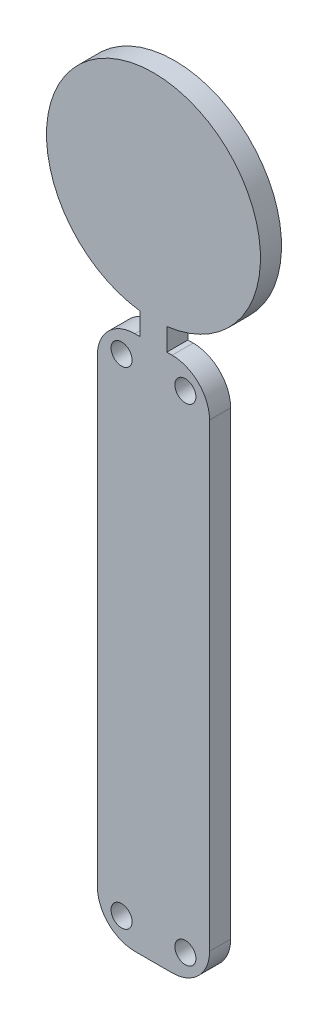
from build123d import *

# Parameters (mm, degrees)
BOSS_EXTRUDE1_DEPTH = 0.25
SKETCH4_R           = 0.25
CUT_EXTRUDE1_DEPTH  = 9.5


with BuildPart() as part:
    # Sketch2 → Boss-Extrude1 (new, symmetric)
    with BuildSketch(Plane.XY):
        with BuildLine():
            Line((-7.074484682, 38.444256199), (-7.074484682, 37.916334323))
            Line((-7.074484682, 37.916334323), (-7.200133049, 37.916334323))
            ThreePointArc((-7.200133049, 37.916334323), (-7.828750978, 37.655952251), (-8.089133049, 37.027334323))
            Line((-8.089133049, 37.027334323), (-8.089133049, 26.105334323))
            ThreePointArc((-8.089133049, 26.105334323), (-7.828750978, 25.476716394), (-7.200133049, 25.216334323))
            Line((-7.200133049, 25.216334323), (-6.313836315, 25.216334323))
            ThreePointArc((-6.313836315, 25.216334323), (-5.685218387, 25.476716394), (-5.424836315, 26.105334323))
            Line((-5.424836315, 26.105334323), (-5.424836315, 37.027334323))
            ThreePointArc((-5.424836315, 37.027334323), (-5.685218387, 37.655952251), (-6.313836315, 37.916334323))
            Line((-6.313836315, 37.916334323), (-6.439484682, 37.916334323))
            Line((-6.439484682, 37.916334323), (-6.439484682, 38.444256199))
            ThreePointArc((-6.439484682, 38.444256199), (-6.756984682, 43.504334323), (-7.074484682, 38.444256199))
        make_face()
    extrude(amount=BOSS_EXTRUDE1_DEPTH, both=True)

    # Sketch4 → Cut-Extrude1 (cut)
    with BuildSketch(Plane.XY.offset(0.25)):
        with Locations((-7.514442014, 25.791025359)):
            Circle(SKETCH4_R)
        with Locations((-5.999527351, 25.791025359)):
            Circle(SKETCH4_R)
        with Locations((-7.514442014, 37.341643287)):
            Circle(SKETCH4_R)
        with Locations((-5.999527351, 37.341643287)):
            Circle(SKETCH4_R)
    extrude(amount=-CUT_EXTRUDE1_DEPTH, mode=Mode.SUBTRACT)


solid = part.part
